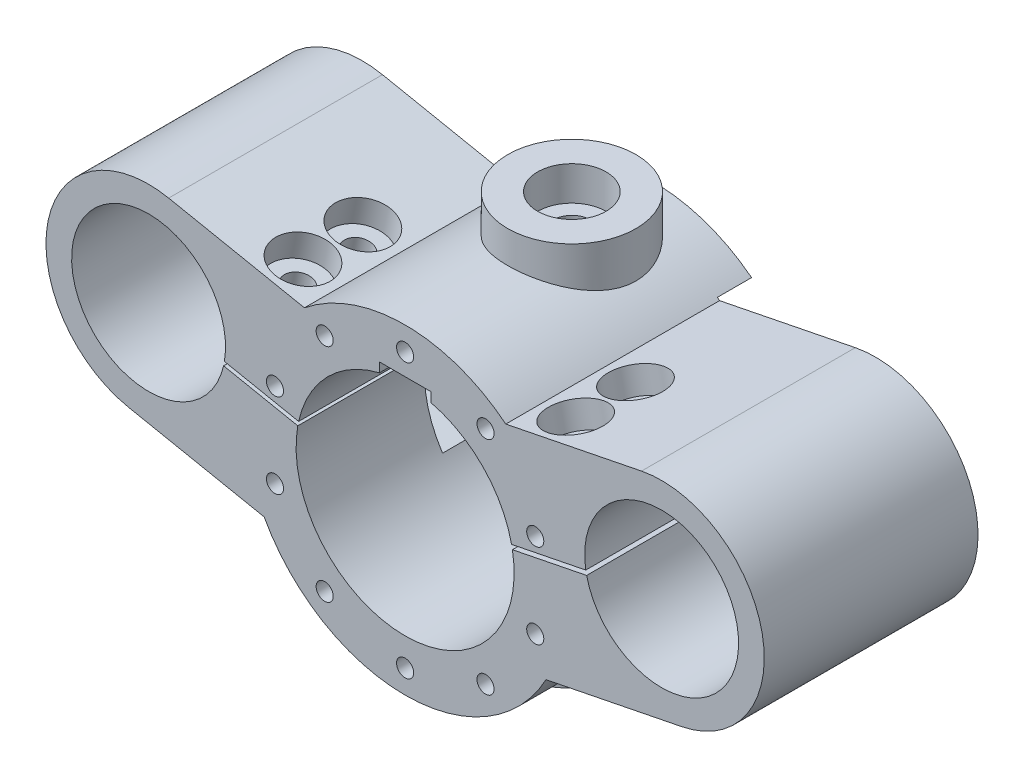
from build123d import *
from build123d.topology import SkipClean

# Parameters (mm, degrees)
SKETCH1_R                      = 18.75
SKETCH1_R_2                    = 12.75
BOSS_EXTRUDE1_DEPTH            = 45
BOSS_EXTRUDE2_DEPTH            = 25
BOSS_EXTRUDE2_2_DEPTH          = 25
BOSS_EXTRUDE3_DEPTH            = 15
BOSS_EXTRUDE4_DEPTH            = 10
SKETCH7_W                      = 10
SKETCH7_H                      = 18
CUT_EXTRUDE1_DEPTH             = 15
SKETCH8_W                      = 10
SKETCH8_H                      = 18
CUT_EXTRUDE2_DEPTH             = 15
CUT_EXTRUDE3_DEPTH             = 15
CBORE_FOR_M3_SHCS1_D           = 3.2
CBORE_FOR_M3_SHCS1_DEPTH       = 11.75
CBORE_FOR_M3_SHCS1_CBORE_D     = 6.5
CBORE_FOR_M3_SHCS1_CBORE_DEPTH = 3
F_1_0MM_DOWEL_HOLE1_D          = 2.5
F_1_0MM_DOWEL_HOLE1_DEPTH      = 24
F_1_0MM_DOWEL_HOLE1_TIP        = 0.751075774
CBORE_FOR_M3_SHCS2_D           = 3.2
CBORE_FOR_M3_SHCS2_DEPTH       = 11.75
CBORE_FOR_M3_SHCS2_CBORE_D     = 6.5
CBORE_FOR_M3_SHCS2_CBORE_DEPTH = 3
CBORE_FOR_M3_SHCS2_TIP         = 0.96137699
F_1_0MM_DOWEL_HOLE2_D          = 2.5
F_1_0MM_DOWEL_HOLE2_DEPTH      = 24
F_1_0MM_DOWEL_HOLE2_TIP        = 0.751075774
F_2_0MM_DOWEL_HOLE2_D          = 1.75
F_2_0MM_DOWEL_HOLE2_DEPTH      = 15
F_2_0MM_DOWEL_HOLE2_TIP        = 0.525753042
BOSS_EXTRUDE5_DEPTH            = 4.5
SKETCH22_W                     = 4.5
SKETCH22_H                     = 24
CUT_EXTRUDE4_DEPTH             = 19.5
SKETCH23_W                     = 4.5
SKETCH23_H                     = 24
CUT_EXTRUDE5_DEPTH             = 19.5
CUT_EXTRUDE6_DEPTH             = 65.347202736
CUT_EXTRUDE6_DEPTH_BACK        = 65.347202736
SKETCH25_W                     = 6
SKETCH25_H                     = 3.5
CUT_EXTRUDE7_START             = -15.5
SKETCH30_R                     = 18.75
CUT_EXTRUDE7_DEPTH             = 15.5
CUT_EXTRUDE8_DEPTH             = 55.642588701
CUT_EXTRUDE8_DEPTH_BACK        = 55.642588701
SKETCH31_W                     = 35
SKETCH31_H                     = 1
BOSS_EXTRUDE7_START            = 15
SKETCH32_R                     = 7.5
BOSS_EXTRUDE7_DEPTH            = 7.5
CBORE_FOR_M4_SHCS4_D           = 4.5
CBORE_FOR_M4_SHCS4_DEPTH       = 33.898063607
CBORE_FOR_M4_SHCS4_CBORE_D     = 8
CBORE_FOR_M4_SHCS4_CBORE_DEPTH = 4
CBORE_FOR_M4_SHCS4_TIP         = 1.351936393
BOSS_EXTRUDE8_START            = -45
SKETCH38_R                     = 7.5
BOSS_EXTRUDE8_DEPTH            = 8
CBORE_FOR_M4_SHCS5_D           = 4.5
CBORE_FOR_M4_SHCS5_DEPTH       = 33.540097339
CBORE_FOR_M4_SHCS5_CBORE_D     = 8
CBORE_FOR_M4_SHCS5_CBORE_DEPTH = 4
CBORE_FOR_M4_SHCS5_TIP         = 1.351936393
CUT_EXTRUDE9_DEPTH             = 56.778580211
CUT_EXTRUDE9_DEPTH_BACK        = 4
CUT_EXTRUDE10_DEPTH            = 2.6
CUT_EXTRUDE11_DEPTH            = 2.6
SKETCH48_R                     = 1
CUT_EXTRUDE12_DEPTH            = 10
SKETCH49_R                     = 0.875
CUT_EXTRUDE13_DEPTH            = 10


with BuildPart() as part:
    # Sketch1 → Boss-Extrude1 (new body)
    with BuildSketch(Plane.XY):
        Circle(SKETCH1_R)
        Circle(SKETCH1_R_2, mode=Mode.SUBTRACT)
    extrude(amount=-BOSS_EXTRUDE1_DEPTH)



with BuildPart() as body_2:
    # Sketch4 → Boss-Extrude2 (new body)
    with BuildSketch(Plane.XY):
        with BuildLine():
            Line((-27.646606378, 17.766968108), (-11.773861134, 14.592419059))
            ThreePointArc((-11.773861134, 14.592419059), (-13.130713482, 13.384575579), (-14.364314659, 12.051098056))
            Line((-14.364314659, 12.051098056), (-28.234954784, 14.825226081))
            ThreePointArc((-28.234954784, 14.825226081), (-38.825226081, 7.765045216), (-31.765045216, -2.825226081))
            Line((-31.765045216, -2.825226081), (-17.894405092, -5.599354106))
            ThreePointArc((-17.894405092, -5.599354106), (-17.268572284, -7.304718426), (-16.480648377, -8.941517157))
            Line((-16.480648377, -8.941517157), (-32.353393622, -5.766968108))
            ThreePointArc((-32.353393622, -5.766968108), (-41.766968108, 8.353393622), (-27.646606378, 17.766968108))
        make_face()
    extrude(amount=-BOSS_EXTRUDE2_DEPTH)


with BuildPart() as body_3:
    # Sketch4 → Boss-Extrude2 2 (new body)
    with BuildSketch(Plane.XY):
        with BuildLine():
            Line((16.480648377, -8.941517157), (32.353393622, -5.766968108))
            ThreePointArc((32.353393622, -5.766968108), (41.766968108, 8.353393622), (27.646606378, 17.766968108))
            Line((27.646606378, 17.766968108), (11.773861134, 14.592419059))
            ThreePointArc((11.773861134, 14.592419059), (13.130713482, 13.384575579), (14.364314659, 12.051098056))
            Line((14.364314659, 12.051098056), (28.234954784, 14.825226081))
            ThreePointArc((28.234954784, 14.825226081), (38.825226081, 7.765045216), (31.765045216, -2.825226081))
            Line((31.765045216, -2.825226081), (17.894405092, -5.599354106))
            ThreePointArc((17.894405092, -5.599354106), (17.268572284, -7.304718426), (16.480648377, -8.941517157))
        make_face()
    extrude(amount=-BOSS_EXTRUDE2_2_DEPTH)


with BuildPart() as part_1:
    with SkipClean():  # the faces are left unmerged after this step: merging them gives an invalid solid
        add(part.part)

        add(body_2.part)  # Boss-Extrude3 merges body 2

        add(body_3.part)  # Boss-Extrude3 merges body 3
        # Sketch5 → Boss-Extrude3 (add)
        with BuildSketch(Plane.XY):
            with BuildLine():
                Line((-28.234954784, 14.825226081), (-14.364314659, 12.051098056))
                ThreePointArc((-14.364314659, 12.051098056), (-18.385887669, 3.677177534), (-17.894405092, -5.599354106))
                Line((-17.894405092, -5.599354106), (-31.765045216, -2.825226081))
                ThreePointArc((-31.765045216, -2.825226081), (-21.174773919, 4.234954784), (-28.234954784, 14.825226081))
            make_face()
            with BuildLine():
                Line((14.364314659, 12.051098056), (28.234954784, 14.825226081))
                ThreePointArc((28.234954784, 14.825226081), (21.174773919, 4.234954784), (31.765045216, -2.825226081))
                Line((31.765045216, -2.825226081), (17.894405092, -5.599354106))
                ThreePointArc((17.894405092, -5.599354106), (18.385887669, 3.677177534), (14.364314659, 12.051098056))
            make_face()
        extrude(amount=-BOSS_EXTRUDE3_DEPTH)

    # Sketch6 → Boss-Extrude4 (add)
    with SkipClean():  # the faces are left unmerged after this step: merging them gives an invalid solid
        with BuildSketch(Plane(origin=(0, 0, -15), x_dir=(-1, 0, 0), z_dir=(0, 0, -1))):
            Polygon((17.846568298, 12.747548784), (19.807729649, 13.139781054), (23.337820081, -4.510671108), (21.37665873, -4.902903378), align=None)
            Polygon((-19.807729649, 13.139781054), (-17.846568298, 12.747548784), (-21.37665873, -4.902903378), (-23.337820081, -4.510671108), align=None)
        extrude(amount=BOSS_EXTRUDE4_DEPTH)

    # Sketch7 → Cut-Extrude1 (cut)
    with SkipClean():  # the faces are left unmerged after this step: merging them gives an invalid solid
        with BuildSketch(Plane(origin=(-21.572774865, 4.314554973, 0), x_dir=(0, 0, 1), z_dir=(-0.98058067569092, 0.19611613513818477, 0))):
            with Locations((-20, 0)):
                Rectangle(SKETCH7_W, SKETCH7_H)
        extrude(amount=-CUT_EXTRUDE1_DEPTH, mode=Mode.SUBTRACT)

    # Sketch8 → Cut-Extrude2 (cut)
    with BuildSketch(Plane(origin=(21.572774865, 4.314554973, 0), x_dir=(0, 0, -1), z_dir=(0.9805806756909202, 0.19611613513818354, 0))):
        with Locations((20, 0)):
            Rectangle(SKETCH8_W, SKETCH8_H)
    extrude(amount=-CUT_EXTRUDE2_DEPTH, mode=Mode.SUBTRACT)

    # Sketch9 → Cut-Extrude3 (cut)
    with BuildSketch(Plane.XY):
        Polygon((11.717939075, 2.598538791), (11.815997142, 2.108248453), (23.58296525, 4.461642074), (23.484907183, 4.951932412), align=None)
        Polygon((-11.815997142, 2.108248453), (-11.717939075, 2.598538791), (-23.484907183, 4.951932412), (-23.58296525, 4.461642074), align=None)
    extrude(amount=-CUT_EXTRUDE3_DEPTH, mode=Mode.SUBTRACT)

    # CBORE for M3 SHCS1
    with Locations(Plane(origin=(2.353393622, 11.766968108, 0), x_dir=(0.9805806756909202, -0.19611613513818402, 0), z_dir=(0.196116135138184, 0.9805806756909201, 0))):
        with Locations((-18.657029534, 4), (-18.657029534, 11)):
            CounterBoreHole(CBORE_FOR_M3_SHCS1_D / 2, CBORE_FOR_M3_SHCS1_CBORE_D / 2, CBORE_FOR_M3_SHCS1_CBORE_DEPTH, depth=CBORE_FOR_M3_SHCS1_DEPTH)

    # Ø1.0mm Dowel Hole1
    with Locations(Plane(origin=(2.353393622, 11.766968108, 0), x_dir=(0.9805806756909202, -0.19611613513818402, 0), z_dir=(0.196116135138184, 0.9805806756909201, 0))):
        with Locations((-18.657029534, 11), (-18.657029534, 4)):
            Hole(F_1_0MM_DOWEL_HOLE1_D / 2, depth=F_1_0MM_DOWEL_HOLE1_DEPTH)
            with Locations((0, 0, -(F_1_0MM_DOWEL_HOLE1_DEPTH + F_1_0MM_DOWEL_HOLE1_TIP / 2))):  # 118° drill point
                Cone(0, F_1_0MM_DOWEL_HOLE1_D / 2, F_1_0MM_DOWEL_HOLE1_TIP, mode=Mode.SUBTRACT)

    # CBORE for M3 SHCS2
    with Locations(Plane(origin=(-2.353393622, 11.766968108, 0), x_dir=(0.9805806756909201, 0.19611613513818432, 0), z_dir=(-0.19611613513818432, 0.9805806756909201, 0))):
        with Locations((18.657029534, 4), (18.657029534, 11)):
            CounterBoreHole(CBORE_FOR_M3_SHCS2_D / 2, CBORE_FOR_M3_SHCS2_CBORE_D / 2, CBORE_FOR_M3_SHCS2_CBORE_DEPTH, depth=CBORE_FOR_M3_SHCS2_DEPTH)
            with Locations((0, 0, -(CBORE_FOR_M3_SHCS2_DEPTH + CBORE_FOR_M3_SHCS2_TIP / 2))):  # 118° drill point
                Cone(0, CBORE_FOR_M3_SHCS2_D / 2, CBORE_FOR_M3_SHCS2_TIP, mode=Mode.SUBTRACT)

    # Ø1.0mm Dowel Hole2
    with Locations(Plane(origin=(-2.353393622, 11.766968108, 0), x_dir=(0.9805806756909201, 0.19611613513818432, 0), z_dir=(-0.19611613513818432, 0.9805806756909201, 0))):
        with Locations((18.657029534, 11), (18.657029534, 4)):
            Hole(F_1_0MM_DOWEL_HOLE2_D / 2, depth=F_1_0MM_DOWEL_HOLE2_DEPTH)
            with Locations((0, 0, -(F_1_0MM_DOWEL_HOLE2_DEPTH + F_1_0MM_DOWEL_HOLE2_TIP / 2))):  # 118° drill point
                Cone(0, F_1_0MM_DOWEL_HOLE2_D / 2, F_1_0MM_DOWEL_HOLE2_TIP, mode=Mode.SUBTRACT)

    # Ø2.0mm Dowel Hole2
    with Locations(Plane(origin=(0, 0, -25), x_dir=(-1, 0, 0), z_dir=(0, 0, -1))):
        with Locations((40.296097095, 8.059219419), (-40.296097095, 8.059219419)):
            Hole(F_2_0MM_DOWEL_HOLE2_D / 2, depth=F_2_0MM_DOWEL_HOLE2_DEPTH)
            with Locations((0, 0, -(F_2_0MM_DOWEL_HOLE2_DEPTH + F_2_0MM_DOWEL_HOLE2_TIP / 2))):  # 118° drill point
                Cone(0, F_2_0MM_DOWEL_HOLE2_D / 2, F_2_0MM_DOWEL_HOLE2_TIP, mode=Mode.SUBTRACT)

    # Sketch21 → Boss-Extrude5 (add)
    with BuildSketch(Plane(origin=(0, 0, -25), x_dir=(-1, 0, 0), z_dir=(0, 0, -1))):
        Polygon((-19.219381244, 16.081523081), (-17.258219892, 15.689290811), (-21.965007135, -7.844645406), (-23.926168487, -7.452413135), align=None)
        Polygon((17.258219892, 15.689290811), (19.219381244, 16.081523081), (23.926168487, -7.452413135), (21.965007135, -7.844645406), align=None)
    extrude(amount=BOSS_EXTRUDE5_DEPTH)

    # Sketch22 → Cut-Extrude4 (cut)
    with BuildSketch(Plane(origin=(-21.572774865, 4.314554973, 0), x_dir=(0, 0, 1), z_dir=(-0.9805806756909202, 0.1961161351381841, 0))):
        with Locations((-27.25, 0)):
            Rectangle(SKETCH22_W, SKETCH22_H)
    extrude(amount=-CUT_EXTRUDE4_DEPTH, mode=Mode.SUBTRACT)

    # Sketch23 → Cut-Extrude5 (cut)
    with BuildSketch(Plane(origin=(21.572774865, 4.314554973, 0), x_dir=(0, 0, -1), z_dir=(0.9805806756909203, 0.19611613513818327, 0))):
        with Locations((27.25, 0)):
            Rectangle(SKETCH23_W, SKETCH23_H)
    extrude(amount=-CUT_EXTRUDE5_DEPTH, mode=Mode.SUBTRACT)

    # Sketch25 → Cut-Extrude6 (cut, two sides: drawn at the far end of the back side and taken through both)
    with BuildSketch(Plane.XY.offset(-CUT_EXTRUDE6_DEPTH_BACK)):
        with Locations((0, 11.75)):
            Rectangle(SKETCH25_W, SKETCH25_H)
    extrude(amount=CUT_EXTRUDE6_DEPTH + CUT_EXTRUDE6_DEPTH_BACK, mode=Mode.SUBTRACT)

    # Sketch30 → Cut-Extrude7 (cut)
    with BuildSketch(Plane(origin=(0, 0, -45), x_dir=(-1, 0, 0), z_dir=(0, 0, -1)).offset(CUT_EXTRUDE7_START)):
        Circle(SKETCH30_R)
    extrude(amount=CUT_EXTRUDE7_DEPTH, mode=Mode.SUBTRACT)

    # Sketch31 → Cut-Extrude8 (cut, two sides: drawn at the far end of the back side and taken through both)
    with BuildSketch(Plane(origin=(0, 0, 0), x_dir=(1, 0, 0), z_dir=(0, 1, 0)).offset(-CUT_EXTRUDE8_DEPTH_BACK)):
        with Locations((0, 29.5)):
            Rectangle(SKETCH31_W, SKETCH31_H)
    extrude(amount=CUT_EXTRUDE8_DEPTH + CUT_EXTRUDE8_DEPTH_BACK, mode=Mode.SUBTRACT)

    # Sketch32 → Boss-Extrude7 (add)
    with BuildSketch(Plane(origin=(0, 0, 0), x_dir=(1, 0, 0), z_dir=(0, 1, 0)).offset(BOSS_EXTRUDE7_START)):
        with Locations(Location((0, 19.5, 0), (0, 0, 90))):
            Circle(SKETCH32_R)
    extrude(amount=BOSS_EXTRUDE7_DEPTH)

    # CBORE for M4 SHCS4
    with Locations(Plane(origin=(0, 22.5, -19.5), x_dir=(0, 0, 1), z_dir=(0, 1, 0))):
        with Locations((0, 0)):
            CounterBoreHole(CBORE_FOR_M4_SHCS4_D / 2, CBORE_FOR_M4_SHCS4_CBORE_D / 2, CBORE_FOR_M4_SHCS4_CBORE_DEPTH, depth=CBORE_FOR_M4_SHCS4_DEPTH)
            with Locations((0, 0, -(CBORE_FOR_M4_SHCS4_DEPTH + CBORE_FOR_M4_SHCS4_TIP / 2))):  # 118° drill point
                Cone(0, CBORE_FOR_M4_SHCS4_D / 2, CBORE_FOR_M4_SHCS4_TIP, mode=Mode.SUBTRACT)

    # Sketch38 → Boss-Extrude8 (add)
    with BuildSketch(Plane(origin=(0, 22.5, 0), x_dir=(1, 0, 0), z_dir=(0, 1, 0)).offset(BOSS_EXTRUDE8_START)):
        with Locations(Location((0, 19.5, 0), (0, 0, 90))):
            Circle(SKETCH38_R)
    extrude(amount=BOSS_EXTRUDE8_DEPTH)

    # CBORE for M4 SHCS5
    with Locations(Plane.XZ.offset(22.5)):
        with Locations((0, -19.5)):
            CounterBoreHole(CBORE_FOR_M4_SHCS5_D / 2, CBORE_FOR_M4_SHCS5_CBORE_D / 2, CBORE_FOR_M4_SHCS5_CBORE_DEPTH, depth=CBORE_FOR_M4_SHCS5_DEPTH)
            with Locations((0, 0, -(CBORE_FOR_M4_SHCS5_DEPTH + CBORE_FOR_M4_SHCS5_TIP / 2))):  # 118° drill point
                Cone(0, CBORE_FOR_M4_SHCS5_D / 2, CBORE_FOR_M4_SHCS5_TIP, mode=Mode.SUBTRACT)

    # Sketch45 → Cut-Extrude9 (cut, two sides: drawn at the far end of the back side and taken through both)
    with BuildSketch(Plane(origin=(0, 0, -29), x_dir=(-1, 0, 0), z_dir=(0, 0, -1)).offset(-CUT_EXTRUDE9_DEPTH_BACK)):
        Polygon((-11.7248321, 14.837564228), (-1.789562502, 12.850510309), (-1.838591536, 12.60536514), (-11.773861134, 14.592419059), align=None)
        Polygon((1.838591536, 12.60536514), (11.773861134, 14.592419059), (11.7248321, 14.837564228), (1.789562502, 12.850510309), align=None)
        Polygon((-16.529677411, -9.186662326), (-16.480648377, -8.941517157), (-1.771938242, -11.883259184), (-1.820967275, -12.128404353), align=None)
        Polygon((1.771938242, -11.883259184), (16.480648377, -8.941517157), (16.529677411, -9.186662326), (1.820967275, -12.128404353), align=None)
    extrude(amount=CUT_EXTRUDE9_DEPTH + CUT_EXTRUDE9_DEPTH_BACK, mode=Mode.SUBTRACT)

    # Sketch24 → Cut-Extrude10 (cut)
    with BuildSketch(Plane(origin=(-2.353393622, -11.766968108, 0), x_dir=(0.9805806756909202, -0.19611613513818407, 0), z_dir=(-0.19611613513818407, -0.9805806756909202, 0))):
        Polygon((-15.481603054, -4), (-17.069316294, -1.25), (-20.244742774, -1.25), (-21.832456015, -4), (-20.244742774, -6.75), (-17.069316294, -6.75), align=None)
        Polygon((-15.481603054, -11), (-17.069316294, -8.25), (-20.244742774, -8.25), (-21.832456015, -11), (-20.244742774, -13.75), (-17.069316294, -13.75), align=None)
    extrude(amount=-CUT_EXTRUDE10_DEPTH, mode=Mode.SUBTRACT)

    # Sketch46 → Cut-Extrude11 (cut)
    with BuildSketch(Plane(origin=(2.353393622, -11.766968108, 0), x_dir=(0.9805806756909202, 0.19611613513818407, 0), z_dir=(0.19611613513818407, -0.9805806756909202, 0))):
        Polygon((21.832456015, -4), (20.244742774, -1.25), (17.069316294, -1.25), (15.481603054, -4), (17.069316294, -6.75), (20.244742774, -6.75), align=None)
        Polygon((21.832456015, -11), (20.244742774, -8.25), (17.069316294, -8.25), (15.481603054, -11), (17.069316294, -13.75), (20.244742774, -13.75), align=None)
    extrude(amount=-CUT_EXTRUDE11_DEPTH, mode=Mode.SUBTRACT)

    # Sketch48 → Cut-Extrude12 (cut)
    with BuildSketch(Plane.XY):
        with Locations((0, 16)):
            Circle(SKETCH48_R)
        with Locations((9.404564037, 12.94427191)):
            Circle(SKETCH48_R)
        with Locations((15.216904261, 4.94427191)):
            Circle(SKETCH48_R)
        with Locations((15.216904261, -4.94427191)):
            Circle(SKETCH48_R)
        with Locations((9.404564037, -12.94427191)):
            Circle(SKETCH48_R)
        with Locations((0, -16)):
            Circle(SKETCH48_R)
        with Locations((-9.404564037, -12.94427191)):
            Circle(SKETCH48_R)
        with Locations((-15.216904261, -4.94427191)):
            Circle(SKETCH48_R)
        with Locations((-15.216904261, 4.94427191)):
            Circle(SKETCH48_R)
        with Locations((-9.404564037, 12.94427191)):
            Circle(SKETCH48_R)
    extrude(amount=-CUT_EXTRUDE12_DEPTH, mode=Mode.SUBTRACT)

    # Sketch49 → Cut-Extrude13 (cut)
    with BuildSketch(Plane(origin=(0, 0, -25), x_dir=(-1, 0, 0), z_dir=(0, 0, -1))):
        with Locations((-18.625264162, 14.432993811)):
            Circle(SKETCH49_R)
        with Locations((-22.743703, -6.159200379)):
            Circle(SKETCH49_R)
        with Locations((18.625264162, 14.432993811)):
            Circle(SKETCH49_R)
        with Locations((22.743703, -6.159200379)):
            Circle(SKETCH49_R)
    extrude(amount=-CUT_EXTRUDE13_DEPTH, mode=Mode.SUBTRACT)


solid = part_1.part
